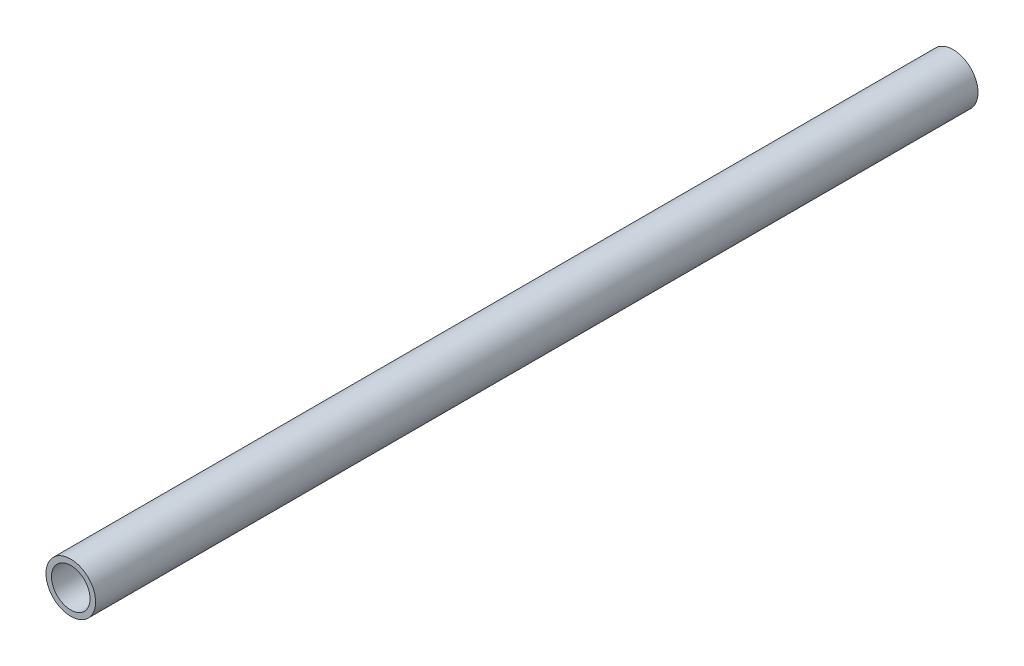
from build123d import *

# Parameters (mm, degrees)
SKETCH1_R           = 9
SKETCH1_R_2         = 7
BOSS_EXTRUDE1_DEPTH = 320.02


with BuildPart() as part:
    # Sketch1 → Boss-Extrude1 (new body)
    with BuildSketch(Plane.XY):
        Circle(SKETCH1_R)
        Circle(SKETCH1_R_2, mode=Mode.SUBTRACT)
    extrude(amount=BOSS_EXTRUDE1_DEPTH)


solid = part.part
